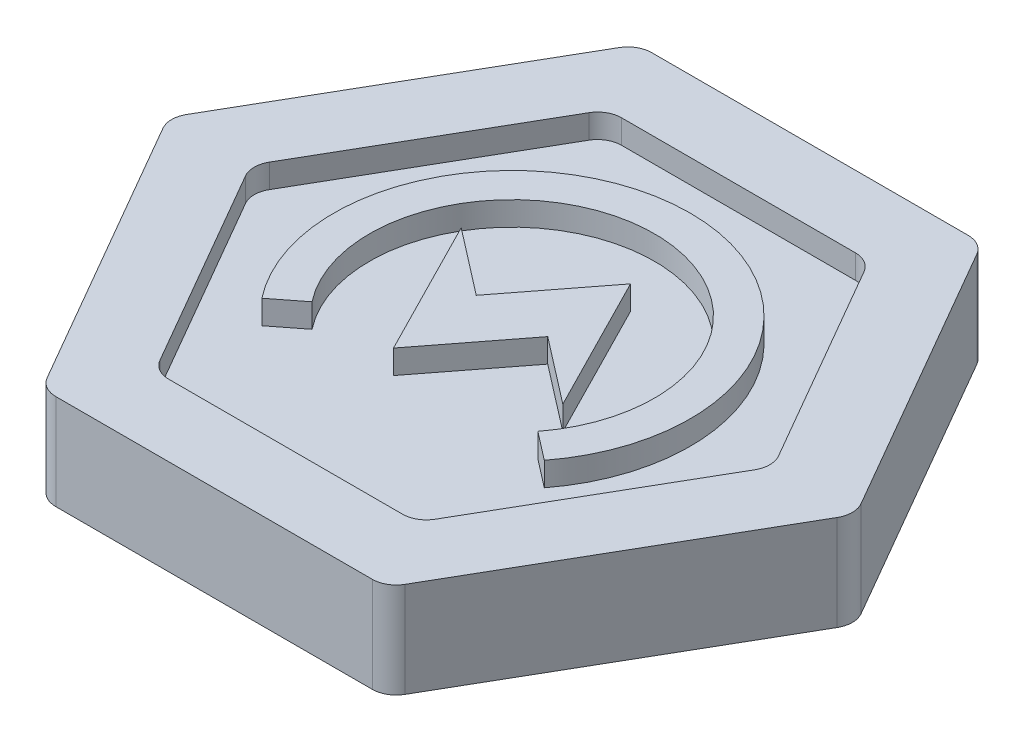
from build123d import *

# Parameters (mm, degrees)
EXTRUDE_1_DEPTH     = 4
CUT_EXTRUDE_1_DEPTH = 1
FILLET_1_R          = 1
EXTRUDE_2_DEPTH     = 1


with BuildPart() as part:
    # 草图1 → 凸台-拉伸1 (new body)
    with BuildSketch(Plane(origin=(0, 0, 0), x_dir=(1, 0, 0), z_dir=(0, 1, 0))):
        Polygon((14.43375673, 0), (7.216878365, 12.5), (-7.216878365, 12.5), (-14.43375673, 0), (-7.216878365, -12.5), (7.216878365, -12.5), align=None)
    extrude(amount=EXTRUDE_1_DEPTH)

    # 草图2 → 切除-拉伸1 (cut)
    with BuildSketch(Plane(origin=(0, 4, 0), x_dir=(1, 0, 0), z_dir=(0, 1, 0))):
        Polygon((5.484827557, -9.5), (10.969655115, 0), (5.484827557, 9.5), (-5.484827557, 9.5), (-10.969655115, 0), (-5.484827557, -9.5), align=None)
    extrude(amount=-CUT_EXTRUDE_1_DEPTH, mode=Mode.SUBTRACT)

    # 圆角1
    fillet_1_edges = [part.edges().sort_by_distance(p)[0] for p in [
        (7.216878365, 2, 12.5),
        (-7.216878365, 2, 12.5),
        (-14.43375673, 2, 0),
        (-7.216878365, 2, -12.5),
        (7.216878365, 2, -12.5),
        (14.43375673, 2, 0),
        (5.484827557, 3.5, 9.5),
        (-5.484827557, 3.5, 9.5),
        (-10.969655115, 3.5, 0),
        (-5.484827557, 3.5, -9.5),
        (5.484827557, 3.5, -9.5),
        (10.969655115, 3.5, 0),
    ]]
    fillet(fillet_1_edges, radius=FILLET_1_R)

    # 草图3 → 凸台-拉伸2 (add)
    with BuildSketch(Plane(origin=(0, 3, 0), x_dir=(1, 0, 0), z_dir=(0, 1, 0))):
        Polygon((4.270525574, -2.13873515), (1.319973126, 3.653003816), (-1.5, 0), (-4.270525574, 2.13873515), (-1.319973126, -3.653003816), (1.5, 0), align=None)
        with BuildLine():
            Line((4.73426289, -3.650545759), (5.922130387, -4.566499256))
            ThreePointArc((5.922130387, -4.566499256), (-0.023704107, 7.478233875), (-5.893062385, -4.603950425))
            Line((-5.893062385, -4.603950425), (-4.71102538, -3.68048493))
            ThreePointArc((-4.71102538, -3.68048493), (-0.018949511, 5.978241411), (4.73426289, -3.650545759))
        make_face()
    extrude(amount=EXTRUDE_2_DEPTH)


solid = part.part
